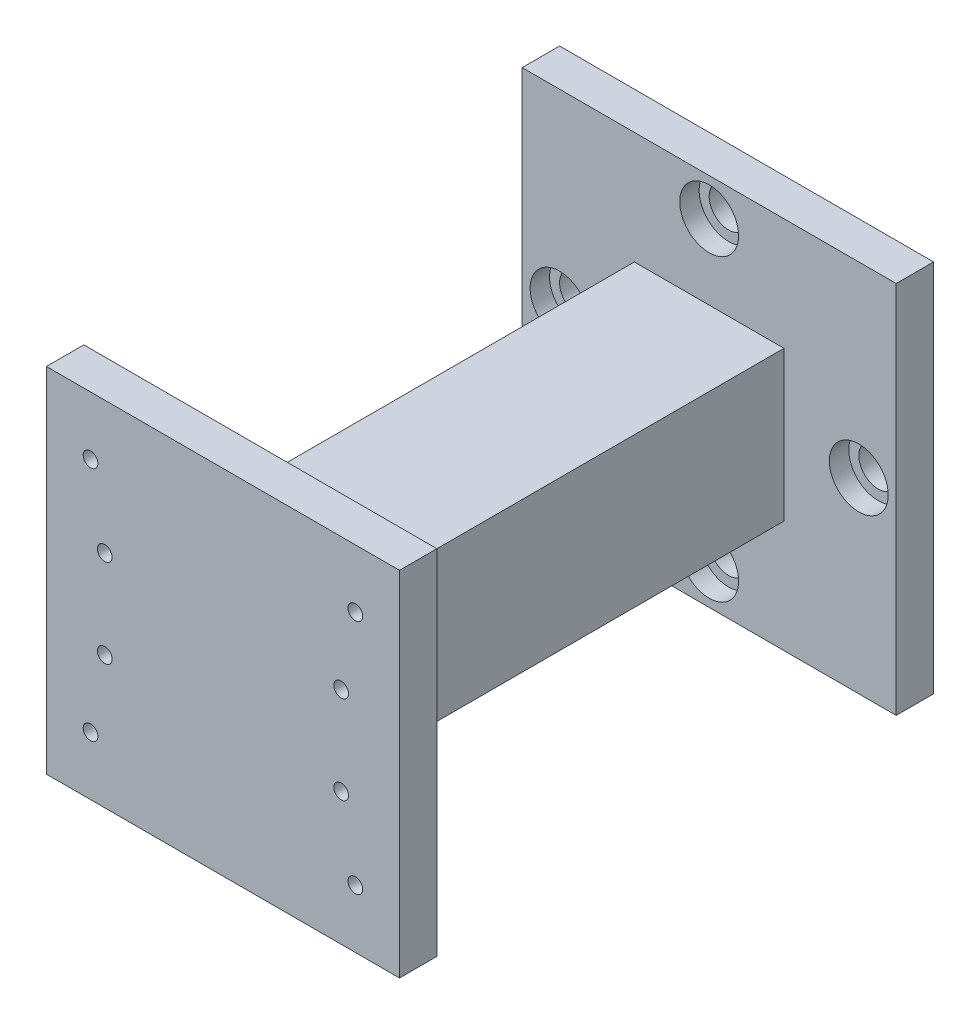
from build123d import *

# Parameters (mm, degrees)
SKETCH2_W                       = 63.5
SKETCH2_H                       = 63.5
BOSS_EXTRUDE2_DEPTH             = 6.35
SKETCH3_W                       = 25.4
SKETCH3_H                       = 25.4
BOSS_EXTRUDE3_DEPTH             = 76.2
SKETCH14_W                      = 59.944
SKETCH14_H                      = 59.944
BOSS_EXTRUDE6_DEPTH             = 6.35
CBORE_FOR_M6_SBHCS2_D           = 6.6
CBORE_FOR_M6_SBHCS2_DEPTH       = 7.62
CBORE_FOR_M6_SBHCS2_CBORE_D     = 10
CBORE_FOR_M6_SBHCS2_CBORE_DEPTH = 3.3
CBORE_FOR_M6_SBHCS2_TIP         = 1.982840043
TAP_DRILL_FOR_M3X0_5_TAP2_D     = 2.5
TAP_DRILL_FOR_M3X0_5_TAP2_DEPTH = 7.62
TAP_DRILL_FOR_M3X0_5_TAP2_TIP   = 0.751075774


with BuildPart() as part:
    # Sketch2 → Boss-Extrude2 (new body)
    with BuildSketch(Plane.XY):
        with Locations((31.75, 31.75)):
            Rectangle(SKETCH2_W, SKETCH2_H)
    extrude(amount=BOSS_EXTRUDE2_DEPTH)

    # Sketch3 → Boss-Extrude3 (add)
    with BuildSketch(Plane.XY.offset(6.35)):
        with Locations((31.75, 31.75)):
            Rectangle(SKETCH3_W, SKETCH3_H)
    extrude(amount=BOSS_EXTRUDE3_DEPTH)

    # Sketch14 → Boss-Extrude6 (add)
    with BuildSketch(Plane.XY.offset(82.55)):
        with Locations((31.75, 31.75)):
            Rectangle(SKETCH14_W, SKETCH14_H)
    extrude(amount=BOSS_EXTRUDE6_DEPTH)

    # CBORE for M6 SBHCS2
    with Locations(Plane.XY.offset(6.35)):
        with Locations((57.15, 31.75), (31.75, 6.35), (31.75, 57.15), (6.35, 31.75)):
            CounterBoreHole(CBORE_FOR_M6_SBHCS2_D / 2, CBORE_FOR_M6_SBHCS2_CBORE_D / 2, CBORE_FOR_M6_SBHCS2_CBORE_DEPTH, depth=CBORE_FOR_M6_SBHCS2_DEPTH)
            with Locations((0, 0, -(CBORE_FOR_M6_SBHCS2_DEPTH + CBORE_FOR_M6_SBHCS2_TIP / 2))):  # 118° drill point
                Cone(0, CBORE_FOR_M6_SBHCS2_D / 2, CBORE_FOR_M6_SBHCS2_TIP, mode=Mode.SUBTRACT)

    # Tap Drill for M3x0.5 Tap2
    with Locations(Plane.XY.offset(88.9)):
        with Locations((9.271, 51.816), (9.271, 11.684), (54.229, 11.684), (54.229, 51.816), (11.684, 39.243), (11.684, 24.257), (51.816, 39.243), (51.816, 24.257)):
            Hole(TAP_DRILL_FOR_M3X0_5_TAP2_D / 2, depth=TAP_DRILL_FOR_M3X0_5_TAP2_DEPTH)
            with Locations((0, 0, -(TAP_DRILL_FOR_M3X0_5_TAP2_DEPTH + TAP_DRILL_FOR_M3X0_5_TAP2_TIP / 2))):  # 118° drill point
                Cone(0, TAP_DRILL_FOR_M3X0_5_TAP2_D / 2, TAP_DRILL_FOR_M3X0_5_TAP2_TIP, mode=Mode.SUBTRACT)


solid = part.part
